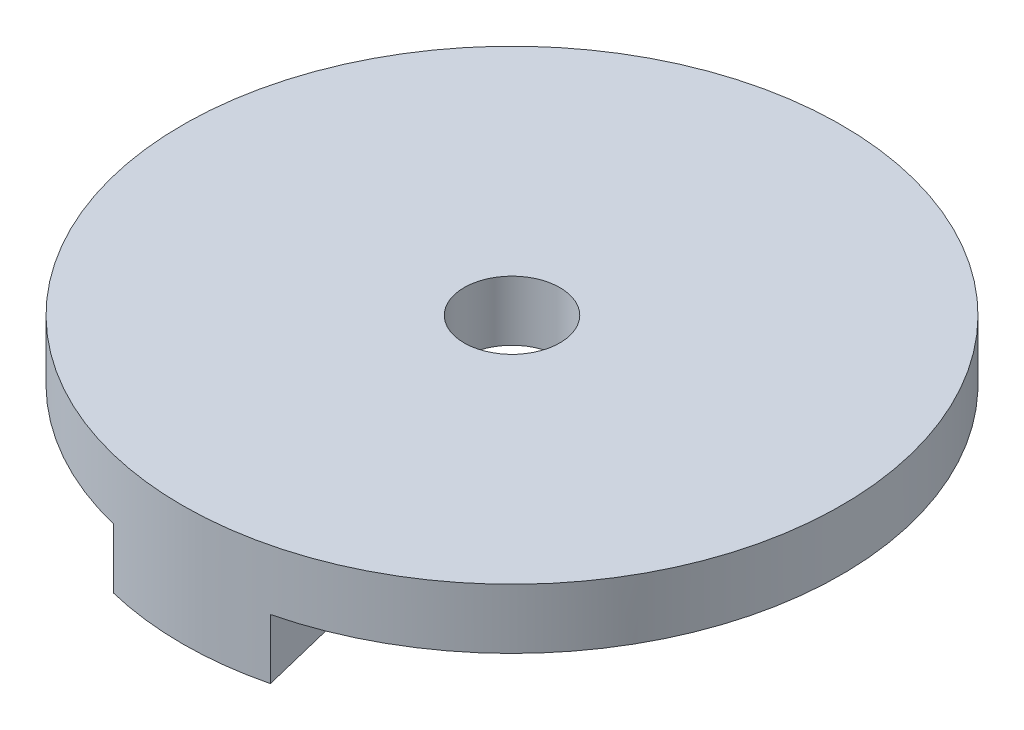
from build123d import *
from build123d.topology import SkipClean

# Parameters (mm, degrees)
SKETCH2_R           = 34.925
SKETCH2_R_2         = 5.08
BOSS_EXTRUDE1_DEPTH = 6.35
BOSS_EXTRUDE2_START = 6.35
BOSS_EXTRUDE2_DEPTH = 6.35


with BuildPart() as part:
    # Sketch2 → Boss-Extrude1 (new body)
    with BuildSketch(Plane(origin=(0, 0, 0), x_dir=(1, 0, 0), z_dir=(0, 1, 0))):
        with Locations(Location((0, 0, 0), (0, 0, 270))):
            Circle(SKETCH2_R)
        with Locations(Location((0, 0, 0), (0, 0, 270))):
            Circle(SKETCH2_R_2, mode=Mode.SUBTRACT)
    extrude(amount=BOSS_EXTRUDE1_DEPTH)

    # Sketch3 → Boss-Extrude2 (add)
    with SkipClean():  # the faces are left unmerged after this step: merging them gives an invalid solid
        with BuildSketch(Plane.XZ.offset(BOSS_EXTRUDE2_START)):
            with BuildLine():
                Line((6.35, 25.903019129), (8.31547619, 33.920620288))
                ThreePointArc((8.31547619, 33.920620288), (0, 34.925), (-8.31547619, 33.920620288))
                Line((-8.31547619, 33.920620288), (-6.35, 25.903019129))
                ThreePointArc((-6.35, 25.903019129), (0, 26.67), (6.35, 25.903019129))
            make_face()
        extrude(amount=-BOSS_EXTRUDE2_DEPTH)


solid = part.part
